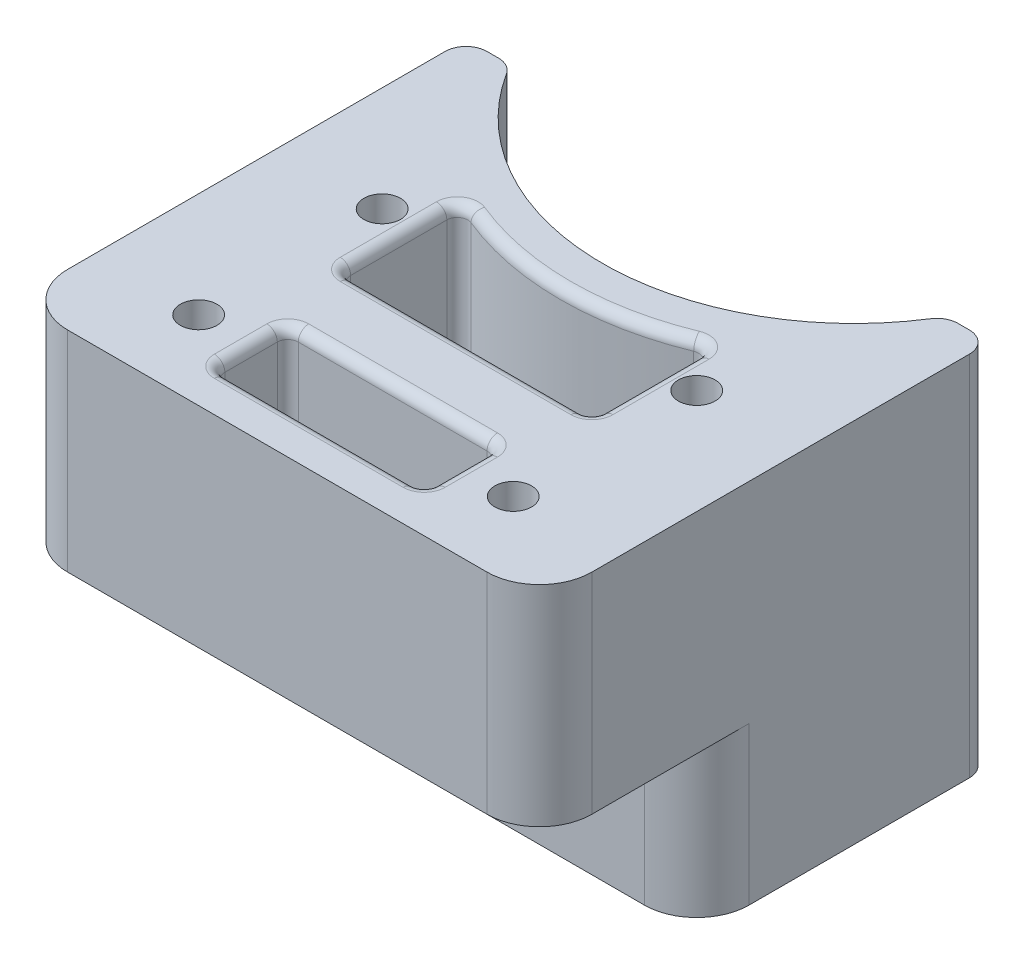
from build123d import *

# Parameters (mm, degrees)
SKETCH_1_W          = 50
SKETCH_1_H          = 50
SKETCH_1_R          = 21.05
EXTRUDE_1_DEPTH     = 15
SKETCH_2_W          = 50
SKETCH_2_H          = 30
SKETCH_2_R          = 1.6
EXTRUDE_2_DEPTH     = 15
FILLET_1_R          = 3
SKETCH_3_R          = 1.75
CUT_EXTRUDE_1_DEPTH = 63.24949799
SKETCH_4_R          = 1.6
CUT_EXTRUDE_2_DEPTH = 63.24949799
EXTRUDE_START       = 20
SKETCH_5_R          = 1.75
SKETCH_5_W          = 50
SKETCH_5_H          = 15
EXTRUDE_3_DEPTH     = 20
FILLET_2_R          = 2
FILLET_3_R          = 5
SKETCH_6_W          = 20
SKETCH_6_H          = 7
CUT_EXTRUDE_3_DEPTH = 64.639610307
CUT_EXTRUDE_4_DEPTH = 70.821200219
FILLET_4_R          = 1


with BuildPart() as part:
    # 草图1 → 凸台-拉伸1 (new body)
    with BuildSketch(Plane(origin=(0, 0, 0), x_dir=(1, 0, 0), z_dir=(0, 1, 0))):
        Rectangle(SKETCH_1_W, SKETCH_1_H)
        with Locations(Location((0, 0, 0), (0, 0, 270))):
            Circle(SKETCH_1_R, mode=Mode.SUBTRACT)
    extrude(amount=EXTRUDE_1_DEPTH)

    # 草图2 → 凸台-拉伸2 (add)
    with BuildSketch(Plane(origin=(0, 15, 0), x_dir=(1, 0, 0), z_dir=(0, 1, 0))):
        with Locations((0, -40)):
            Rectangle(SKETCH_2_W, SKETCH_2_H)
        with Locations(Location((-15, -47.5, 0), (0, 0, 270))):
            Circle(SKETCH_2_R, mode=Mode.SUBTRACT)
        with Locations(Location((15, -47.5, 0), (0, 0, 270))):
            Circle(SKETCH_2_R, mode=Mode.SUBTRACT)
    extrude(amount=-EXTRUDE_2_DEPTH)

    # 圆角1
    fillet_1_edges = [part.edges().sort_by_distance(p)[0] for p in [
        (25, 7.5, 55),
        (-25, 7.5, 55),
        (-25, 7.5, -25),
        (25, 7.5, -25),
    ]]
    fillet(fillet_1_edges, radius=FILLET_1_R)

    # 草图3 → 切除-拉伸1 (cut, through all)
    with BuildSketch(Plane(origin=(0, 15, 0), x_dir=(1, 0, 0), z_dir=(0, 1, 0))):
        with Locations(Location((-15, -30, 0), (0, 0, 270))):
            Circle(SKETCH_3_R)
        with Locations(Location((15, -30, 0), (0, 0, 270))):
            Circle(SKETCH_3_R)
    extrude(amount=-CUT_EXTRUDE_1_DEPTH, mode=Mode.SUBTRACT)

    # 草图4 → 切除-拉伸2 (cut, through all)
    # profile 1 of 6: a face of its own
    with BuildSketch(Plane(origin=(0, 15, 0), x_dir=(1, 0, 0), z_dir=(0, 1, 0))):
        with BuildLine():
            Line((25, -40), (-25, -40))
            Line((-25, -40), (-25, -52))
            ThreePointArc((-25, -52), (-24.121320344, -54.121320344), (-22, -55))
            Line((-22, -55), (22, -55))
            ThreePointArc((22, -55), (24.121320344, -54.121320344), (25, -52))
            Line((25, -52), (25, -40))
        make_face()
        with Locations((-15, -47.5)):
            Circle(SKETCH_4_R, mode=Mode.SUBTRACT)
        with Locations((15, -47.5)):
            Circle(SKETCH_4_R, mode=Mode.SUBTRACT)
    # profile 2 of 6: a face of its own
    with BuildSketch(Plane(origin=(0, 15, 0), x_dir=(1, 0, 0), z_dir=(0, 1, 0))):
        with BuildLine():
            Line((-25, 22), (-25, -12))
            Line((-25, -12), (-20.784609691, -12))
            ThreePointArc((-20.784609691, -12), (-6.211657082, 23.182219831), (24, 0))
            ThreePointArc((24, 0), (23.182219831, -6.211657082), (20.784609691, -12))
            Line((20.784609691, -12), (25, -12))
            Line((25, -12), (25, 22))
            ThreePointArc((25, 22), (24.121320344, 24.121320344), (22, 25))
            Line((22, 25), (-22, 25))
            ThreePointArc((-22, 25), (-24.121320344, 24.121320344), (-25, 22))
        make_face()
    # profile 3 of 6: a face of its own
    with BuildSketch(Plane(origin=(0, 15, 0), x_dir=(1, 0, 0), z_dir=(0, 1, 0))):
        with BuildLine():
            ThreePointArc((24, 0), (-6.211657082, 23.182219831), (-20.784609691, -12))
            Line((-20.784609691, -12), (-17.294580076, -12))
            ThreePointArc((-17.294580076, -12), (-6.286954326, 20.089218633), (21.05, 0))
            ThreePointArc((21.05, 0), (20.089218633, -6.286954326), (17.294580076, -12))
            Line((17.294580076, -12), (20.784609691, -12))
            ThreePointArc((20.784609691, -12), (23.182219831, -6.211657082), (24, 0))
        make_face()
    # profile 4 of 6: a face of its own
    with BuildSketch(Plane(origin=(0, 15, 0), x_dir=(1, 0, 0), z_dir=(0, 1, 0))):
        with BuildLine():
            Line((-17.294580076, -12), (-20.784609691, -12))
            ThreePointArc((-20.784609691, -12), (0, -24), (20.784609691, -12))
            Line((20.784609691, -12), (17.294580076, -12))
            ThreePointArc((17.294580076, -12), (0, -21.05), (-17.294580076, -12))
        make_face()
    # profile 5 of 6: a face of its own
    with BuildSketch(Plane(origin=(0, 15, 0), x_dir=(1, 0, 0), z_dir=(0, 1, 0))):
        with BuildLine():
            ThreePointArc((24, 0), (-6.211657082, 23.182219831), (-20.784609691, -12))
            Line((-20.784609691, -12), (-17.294580076, -12))
            ThreePointArc((-17.294580076, -12), (-6.286954326, 20.089218633), (21.05, 0))
            ThreePointArc((21.05, 0), (20.089218633, -6.286954326), (17.294580076, -12))
            Line((17.294580076, -12), (20.784609691, -12))
            ThreePointArc((20.784609691, -12), (23.182219831, -6.211657082), (24, 0))
        make_face()
    # profile 6 of 6: a face of its own
    with BuildSketch(Plane(origin=(0, 15, 0), x_dir=(1, 0, 0), z_dir=(0, 1, 0))):
        with BuildLine():
            Line((-17.294580076, -12), (-20.784609691, -12))
            ThreePointArc((-20.784609691, -12), (0, -24), (20.784609691, -12))
            Line((20.784609691, -12), (17.294580076, -12))
            ThreePointArc((17.294580076, -12), (0, -21.05), (-17.294580076, -12))
        make_face()
    extrude(amount=-CUT_EXTRUDE_2_DEPTH, mode=Mode.SUBTRACT)

    # 草图5 → 凸台-拉伸3 (add)
    # profile 1 of 2: a face of its own
    with BuildSketch(Plane(origin=(0, 15, 0), x_dir=(1, 0, 0), z_dir=(0, 1, 0)).offset(EXTRUDE_START)):
        with BuildLine():
            Line((-25, -12), (-25, -40))
            Line((-25, -40), (25, -40))
            Line((25, -40), (25, -12))
            Line((25, -12), (20.784609691, -12))
            ThreePointArc((20.784609691, -12), (0, -24), (-20.784609691, -12))
            Line((-20.784609691, -12), (-25, -12))
        make_face()
        with Locations(Location((-15, -30, 0), (0, 0, 270))):
            Circle(SKETCH_5_R, mode=Mode.SUBTRACT)
        with Locations(Location((15, -30, 0), (0, 0, 270))):
            Circle(SKETCH_5_R, mode=Mode.SUBTRACT)
    # profile 2 of 2: a face of its own
    with BuildSketch(Plane(origin=(0, 15, 0), x_dir=(1, 0, 0), z_dir=(0, 1, 0)).offset(EXTRUDE_START)):
        with Locations((0, -47.5)):
            Rectangle(SKETCH_5_W, SKETCH_5_H)
        with Locations(Location((15, -47.5, 0), (0, 0, 270))):
            Circle(SKETCH_5_R, mode=Mode.SUBTRACT)
        with Locations(Location((-15, -47.5, 0), (0, 0, 270))):
            Circle(SKETCH_5_R, mode=Mode.SUBTRACT)
    extrude(amount=-EXTRUDE_3_DEPTH)

    # 圆角2
    fillet_2_edges = [part.edges().sort_by_distance(p)[0] for p in [
        (20.784609691, 17.5, 12),
        (-20.784609691, 17.5, 12),
        (-25, 17.5, 12),
        (25, 17.5, 12),
    ]]
    fillet(fillet_2_edges, radius=FILLET_2_R)

    # 圆角3
    fillet_3_edges = [part.edges().sort_by_distance(p)[0] for p in [
        (-25, 25, 55),
        (25, 25, 55),
        (-25, 7.5, 40),
        (25, 7.5, 40),
    ]]
    fillet(fillet_3_edges, radius=FILLET_3_R)

    # 草图6 → 切除-拉伸3 (cut, through all)
    with BuildSketch(Plane.XZ.offset(-15)):
        with Locations((0, 47.5)):
            Rectangle(SKETCH_6_W, SKETCH_6_H)
    extrude(amount=-CUT_EXTRUDE_3_DEPTH, mode=Mode.SUBTRACT)

    # 草图7 → 切除-拉伸4 (cut, through all)
    with BuildSketch(Plane.XZ):
        with BuildLine():
            Line((0, 37), (0, 28))
            ThreePointArc((0, 28), (6.150195286, 27.316205775), (12, 25.298221281))
            Line((12, 25.298221281), (12, 37))
            Line((12, 37), (0, 37))
        make_face()
        with BuildLine():
            ThreePointArc((-12, 25.298221281), (-6.150195286, 27.316205775), (0, 28))
            Line((0, 28), (0, 37))
            Line((0, 37), (-12, 37))
            Line((-12, 37), (-12, 25.298221281))
        make_face()
    extrude(amount=-CUT_EXTRUDE_4_DEPTH, mode=Mode.SUBTRACT)

    # 圆角4
    fillet_4_edges = [part.edges().sort_by_distance(p)[0] for p in [
        (10, 35, 47.5),
        (10, 25, 51),
        (0, 35, 44),
        (10, 25, 44),
        (-10, 35, 47.5),
        (-10, 25, 44),
        (0, 35, 51),
        (-10, 25, 51),
        (10, 15, 47.5),
        (0, 15, 51),
        (-10, 15, 47.5),
        (0, 15, 44),
        (0, 0, 37),
        (-12, 17.5, 37),
        (12, 0, 31.149110641),
        (12, 17.5, 37),
        (0, 0, 28),
        (12, 17.5, 25.298221281),
        (-12, 35, 31.149110641),
        (-12, 17.5, 25.298221281),
        (0, 35, 37),
        (12, 35, 31.149110641),
        (0, 35, 28),
        (-12, 0, 31.149110641),
    ]]
    fillet(fillet_4_edges, radius=FILLET_4_R)


solid = part.part
